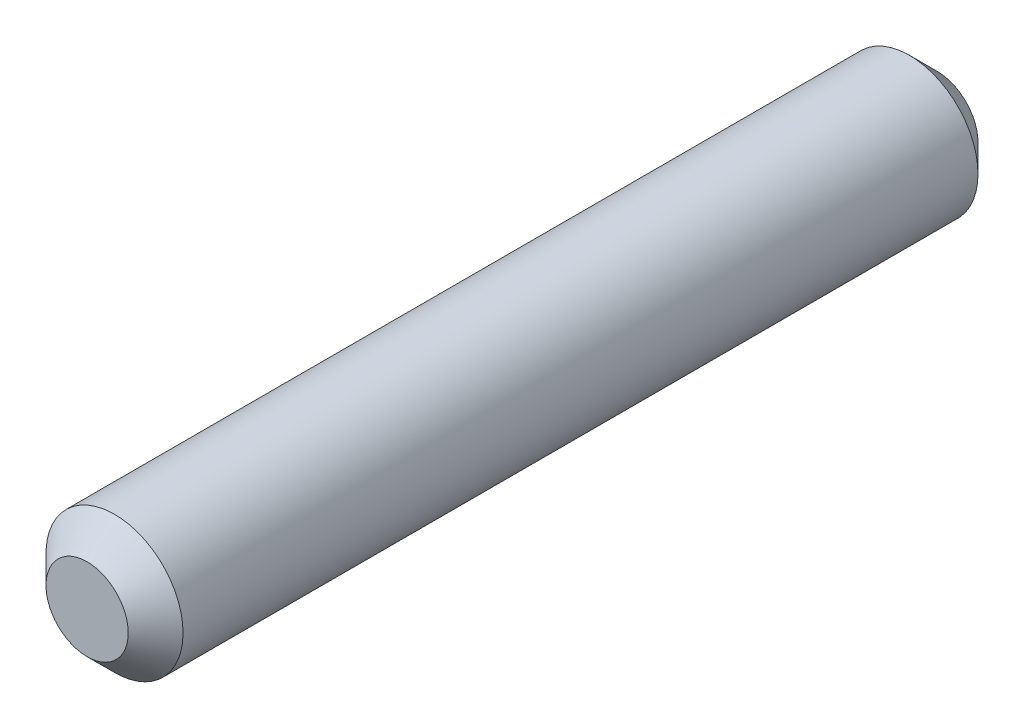
from build123d import *

# Parameters (mm, degrees)
SKETCH_1_R      = 5
EXTRUDE_1_DEPTH = 31
CHAMFER_1_SIZE  = 2


with BuildPart() as part:
    # 草图1 → 凸台-拉伸1 (new, symmetric)
    with BuildSketch(Plane.XY):
        Circle(SKETCH_1_R)
    extrude(amount=EXTRUDE_1_DEPTH, both=True)

    # 倒角1
    chamfer_1_edges = [part.edges().sort_by_distance(p)[0] for p in [
        (-5, 0, -31),
        (-5, 0, 31),
    ]]
    chamfer(chamfer_1_edges, length=CHAMFER_1_SIZE)


solid = part.part
